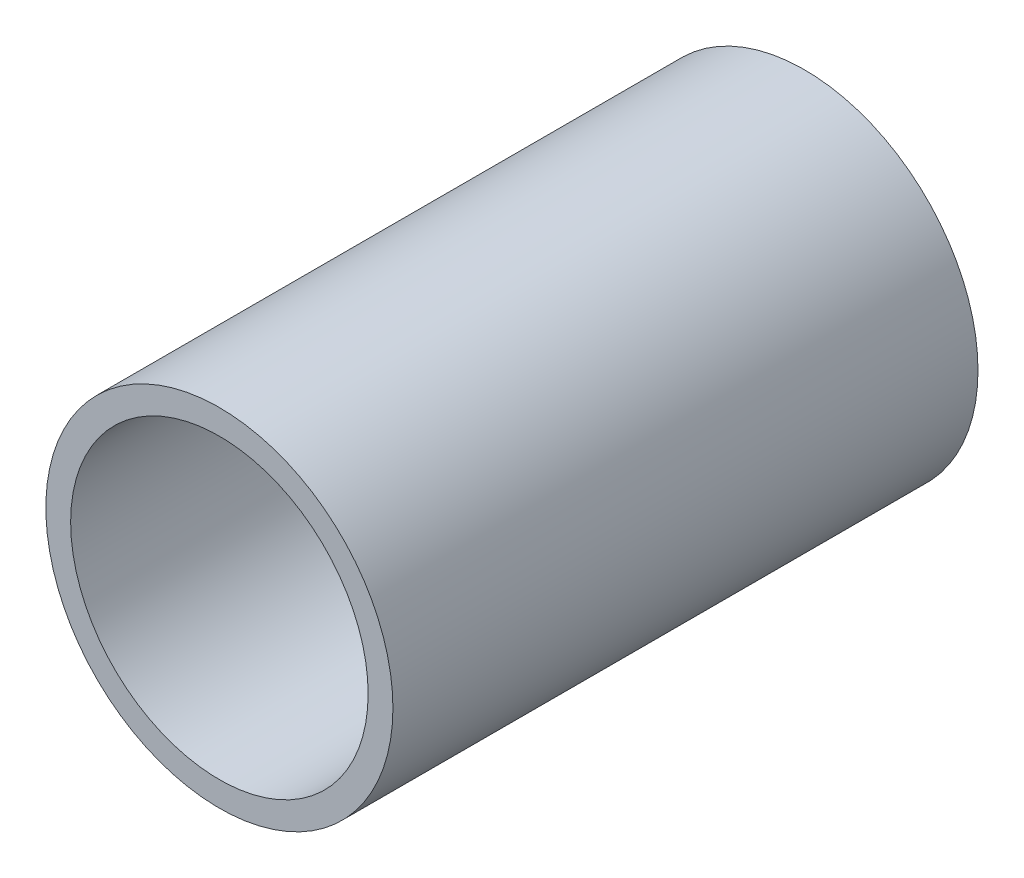
from build123d import *

# Parameters (mm, degrees)
SKETCH1_R           = 44.45
SKETCH1_R_2         = 38.1
BOSS_EXTRUDE1_DEPTH = 74.93


with BuildPart() as part:
    # Sketch1 → Boss-Extrude1 (new, symmetric)
    with BuildSketch(Plane.XY):
        Circle(SKETCH1_R)
        Circle(SKETCH1_R_2, mode=Mode.SUBTRACT)
    extrude(amount=BOSS_EXTRUDE1_DEPTH, both=True)


solid = part.part
